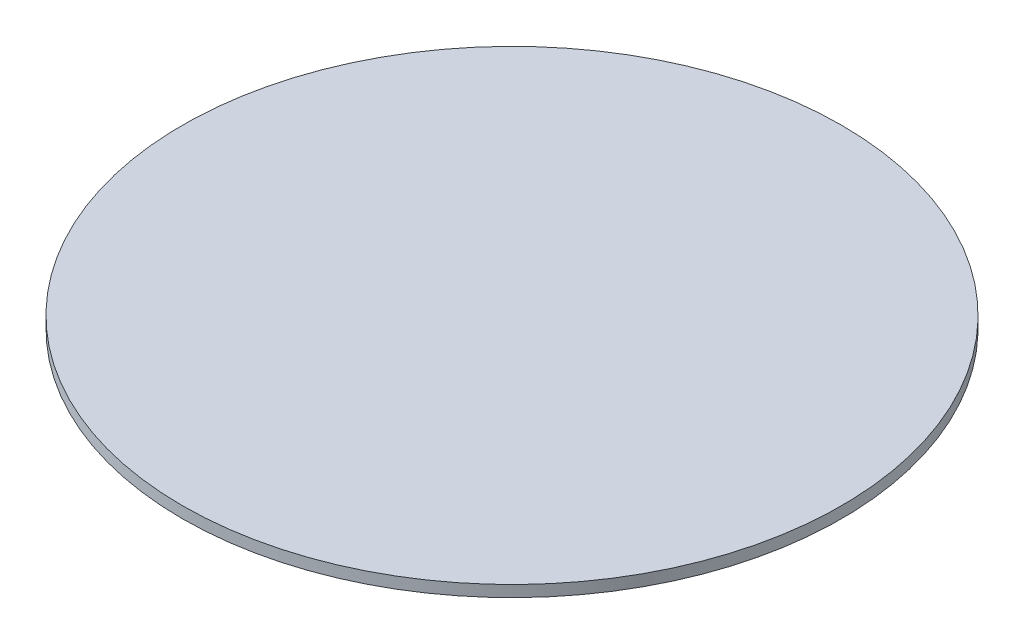
from build123d import *

# Parameters (mm, degrees)
SKETCH1_R           = 92.075
BOSS_EXTRUDE1_DEPTH = 3.175


with BuildPart() as part:
    # Sketch1 → Boss-Extrude1 (new body)
    with BuildSketch(Plane(origin=(0, 0, 0), x_dir=(1, 0, 0), z_dir=(0, 1, 0))):
        with Locations(Location((0, 0, 0), (0, 0, 270))):
            Circle(SKETCH1_R)
    extrude(amount=BOSS_EXTRUDE1_DEPTH)


solid = part.part
